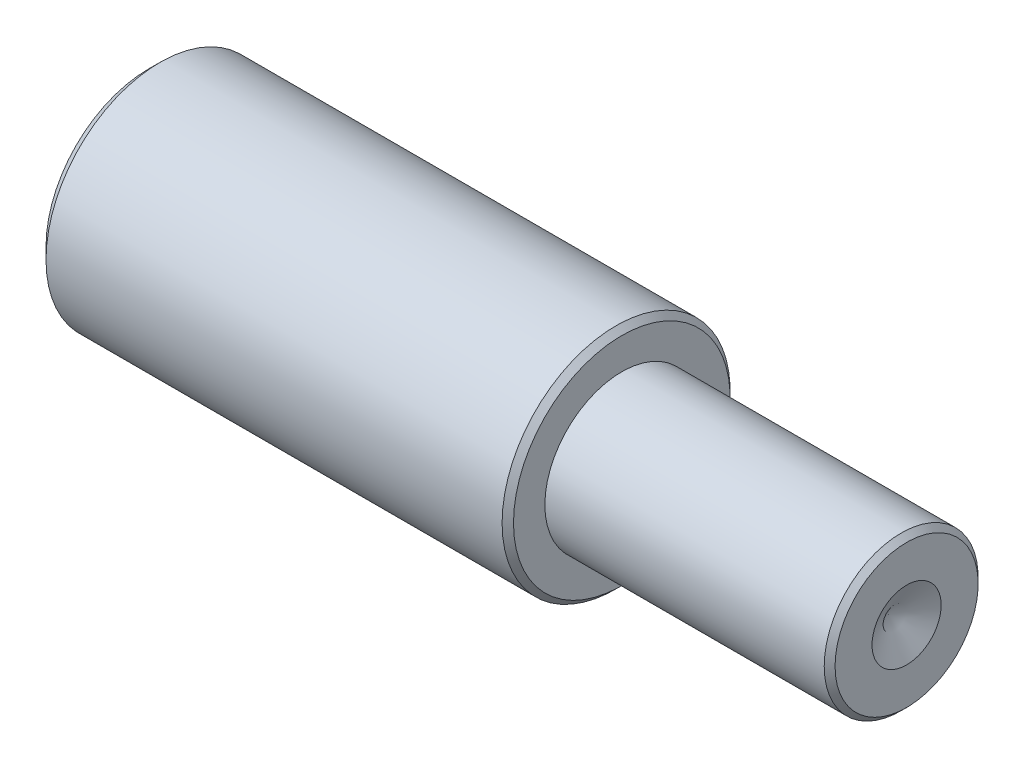
from build123d import *


with BuildPart() as part:
    # Эскиз2 → Повернуть2 (revolve)
    with BuildSketch(Plane(origin=(0, 0, 0), x_dir=(1, 0, 0), z_dir=(0, 1, 0)), mode=Mode.PRIVATE) as revolve_2_sk:
        Polygon((-45.527497303, 22.337527379), (34.472502697, 22.337527379), (35.472502697, 21.337527379), (35.472502697, 15.837527379), (84.472502697, 15.837527379), (85.424546547, 14.885483529), (85.424546547, 8.400853563), (82.259183132, 2.337527379), (-47.527497303, 2.337527379), (-47.527497303, 20.337527379), align=None)
    revolve(revolve_2_sk.sketch.rotate(Axis((-58.608041749, 0, -2.337527379), (1, 0, 0)), 180), axis=Axis((-58.608041749, 0, -2.337527379), (1, 0, 0)))


solid = part.part
